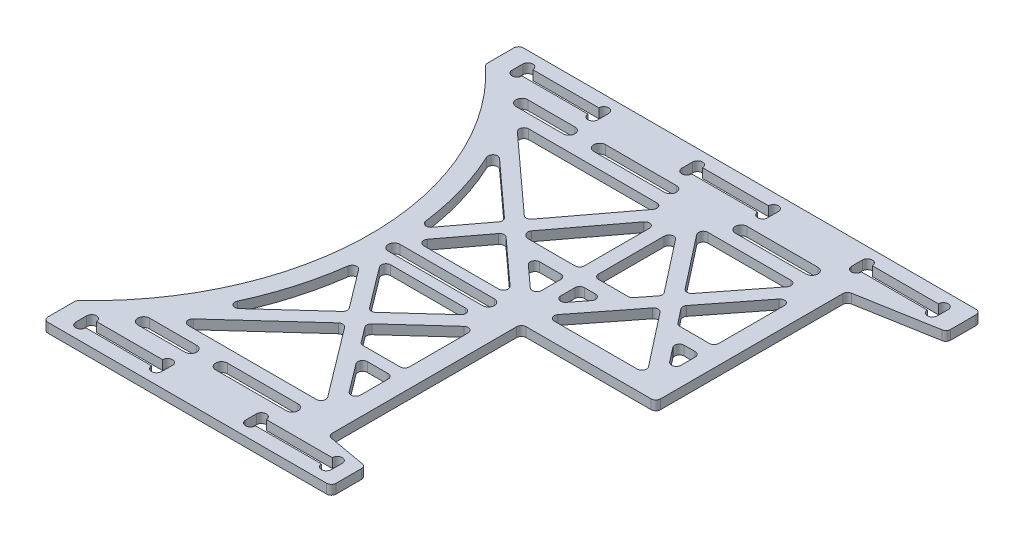
from build123d import *

# Parameters (mm, degrees)
EXTRUDE_1_DEPTH = 2
FILLET_1_R      = 1


with BuildPart() as part:
    # 草图1 → 凸台-拉伸1 (new body)
    with BuildSketch(Plane(origin=(0, 0, 0), x_dir=(1, 0, 0), z_dir=(0, 1, 0))):
        with BuildLine():
            Line((-49, -50.4), (12.1, -50.4))
            Line((12.1, -50.4), (12.1, -43.173885653))
            Line((12.1, -43.173885653), (2.5, -41.481146638))
            Line((2.5, -41.481146638), (2.5, -39.004758069))
            Line((2.5, -39.004758069), (2.5, -0.5))
            Line((2.5, -0.5), (31, -0.5))
            Line((31, -0.5), (31, 40))
            Line((31, 40), (49, 43.173885653))
            Line((49, 43.173885653), (49, 50.4))
            Line((49, 50.4), (-49, 50.4))
            Line((-49, 50.4), (-49, 43.370496884))
            ThreePointArc((-49, 43.370496884), (-30, 0), (-49, -43.370496884))
            Line((-49, -43.370496884), (-49, -50.4))
        make_face()
        with BuildLine():
            Line((-26.9, -45.1), (-26.9, -47.4))
            ThreePointArc((-26.9, -47.4), (-27.95, -48.45), (-29, -47.4))
            Line((-29, -47.4), (-43, -47.4))
            ThreePointArc((-43, -47.4), (-44.05, -48.45), (-45.1, -47.4))
            Line((-45.1, -47.4), (-45.1, -45.1))
            ThreePointArc((-45.1, -45.1), (-44.05, -44.05), (-43, -45.1))
            Line((-43, -45.1), (-29, -45.1))
            ThreePointArc((-29, -45.1), (-27.95, -44.05), (-26.9, -45.1))
        make_face(mode=Mode.SUBTRACT)
        with BuildLine():
            Line((-28, -41.35), (-38, -41.35))
            ThreePointArc((-38, -41.35), (-39.25, -40.1), (-38, -38.85))
            Line((-38, -38.85), (-28, -38.85))
            ThreePointArc((-28, -38.85), (-26.75, -40.1), (-28, -41.35))
        make_face(mode=Mode.SUBTRACT)
        with BuildLine():
            Line((-6.5, -41.35), (-21.5, -41.35))
            ThreePointArc((-21.5, -41.35), (-22.75, -40.1), (-21.5, -38.85))
            Line((-21.5, -38.85), (-6.5, -38.85))
            ThreePointArc((-6.5, -38.85), (-5.25, -40.1), (-6.5, -41.35))
        make_face(mode=Mode.SUBTRACT)
        with BuildLine():
            ThreePointArc((-7, -47.4), (-8.05, -48.45), (-9.1, -47.4))
            Line((-9.1, -47.4), (-9.1, -45.1))
            ThreePointArc((-9.1, -45.1), (-8.05, -44.05), (-7, -45.1))
            Line((-7, -45.1), (7, -45.1))
            ThreePointArc((7, -45.1), (8.05, -44.05), (9.1, -45.1))
            Line((9.1, -45.1), (9.1, -47.4))
            ThreePointArc((9.1, -47.4), (8.05, -48.45), (7, -47.4))
            Line((7, -47.4), (-7, -47.4))
        make_face(mode=Mode.SUBTRACT)
        Polygon((-3.379074314, -36.1), (-35.13850413, -36.1), (-16.298665995, -18.977033898), align=None, mode=Mode.SUBTRACT)
        Polygon((-1.5, -23.75), (-1.5, -33.609571001), (-8.939226985, -23.75), align=None, mode=Mode.SUBTRACT)
        with BuildLine():
            ThreePointArc((-34.333863559, -31.314749346), (-28.925646328, -18.975564048), (-26.264658616, -5.768616943))
            Line((-26.264658616, -5.768616943), (-18.113142059, -16.572220116))
            Line((-18.113142059, -16.572220116), (-34.333863559, -31.314749346))
        make_face(mode=Mode.SUBTRACT)
        Polygon((-10.825522794, -21.25), (-14.069315146, -16.950843506), (-1.5, -5.526968438), (-1.5, -21.25), align=None, mode=Mode.SUBTRACT)
        Polygon((-15.88379121, -14.546029724), (-24.218223041, -3.5), (-3.730206907, -3.5), align=None, mode=Mode.SUBTRACT)
        with BuildLine():
            ThreePointArc((-26.264658616, 5.768616943), (-28.925646328, 18.975564048), (-34.333863559, 31.314749346))
            Line((-34.333863559, 31.314749346), (-18.113142059, 16.572220116))
            Line((-18.113142059, 16.572220116), (-26.264658616, 5.768616943))
        make_face(mode=Mode.SUBTRACT)
        with BuildLine():
            ThreePointArc((-25, -1.25), (-26.25, 0), (-25, 1.25))
            Line((-25, 1.25), (-5, 1.25))
            ThreePointArc((-5, 1.25), (-3.75, 0), (-5, -1.25))
            Line((-5, -1.25), (-25, -1.25))
        make_face(mode=Mode.SUBTRACT)
        Polygon((-3.730206907, 3.5), (-24.218223041, 3.5), (-15.88379121, 14.546029724), align=None, mode=Mode.SUBTRACT)
        Polygon((-9.557291504, 12.85), (-1.5, 12.85), (-1.5, 5.526968438), align=None, mode=Mode.SUBTRACT)
        Polygon((-1.5, 15.85), (-12.858093133, 15.85), (-14.069315146, 16.950843506), (-9.910231684, 22.463080029), (-1.5, 33.609571001), align=None, mode=Mode.SUBTRACT)
        with BuildLine():
            ThreePointArc((-38, 38.85), (-39.25, 40.1), (-38, 41.35))
            Line((-38, 41.35), (-28, 41.35))
            ThreePointArc((-28, 41.35), (-26.75, 40.1), (-28, 38.85))
            Line((-28, 38.85), (-38, 38.85))
        make_face(mode=Mode.SUBTRACT)
        with BuildLine():
            Line((-45.1, 45.1), (-45.1, 47.4))
            ThreePointArc((-45.1, 47.4), (-44.05, 48.45), (-43, 47.4))
            Line((-43, 47.4), (-29, 47.4))
            ThreePointArc((-29, 47.4), (-27.95, 48.45), (-26.9, 47.4))
            Line((-26.9, 47.4), (-26.9, 45.1))
            ThreePointArc((-26.9, 45.1), (-27.95, 44.05), (-29, 45.1))
            Line((-29, 45.1), (-43, 45.1))
            ThreePointArc((-43, 45.1), (-44.05, 44.05), (-45.1, 45.1))
        make_face(mode=Mode.SUBTRACT)
        Polygon((-16.298665995, 18.977033898), (-35.13850413, 36.1), (-3.379074314, 36.1), align=None, mode=Mode.SUBTRACT)
        with BuildLine():
            ThreePointArc((-21.5, 38.85), (-22.75, 40.1), (-21.5, 41.35))
            Line((-21.5, 41.35), (-6.5, 41.35))
            ThreePointArc((-6.5, 41.35), (-5.25, 40.1), (-6.5, 38.85))
            Line((-6.5, 38.85), (-21.5, 38.85))
        make_face(mode=Mode.SUBTRACT)
        with BuildLine():
            ThreePointArc((-9.1, 47.4), (-8.05, 48.45), (-7, 47.4))
            Line((-7, 47.4), (7, 47.4))
            ThreePointArc((7, 47.4), (8.05, 48.45), (9.1, 47.4))
            Line((9.1, 47.4), (9.1, 45.1))
            ThreePointArc((9.1, 45.1), (8.05, 44.05), (7, 45.1))
            Line((7, 45.1), (-7, 45.1))
            ThreePointArc((-7, 45.1), (-8.05, 44.05), (-9.1, 45.1))
            Line((-9.1, 45.1), (-9.1, 47.4))
        make_face(mode=Mode.SUBTRACT)
        Polygon((1.5, 5.934619116), (1.5, 12.85), (6.909270323, 12.85), align=None, mode=Mode.SUBTRACT)
        Polygon((25.095620016, 3.5), (3.404379984, 3.5), (14.25, 17.365380884), align=None, mode=Mode.SUBTRACT)
        Polygon((27, 5.934619116), (21.590729677, 12.85), (27, 12.85), align=None, mode=Mode.SUBTRACT)
        Polygon((1.5, 15.85), (1.5, 33.665380884), (8.282386908, 24.994564679), (12.345620016, 19.8), (9.25589609, 15.85), align=None, mode=Mode.SUBTRACT)
        Polygon((16.154379984, 19.8), (27, 33.665380884), (27, 15.85), (19.24410391, 15.85), align=None, mode=Mode.SUBTRACT)
        Polygon((14.25, 22.234619116), (3.404379984, 36.1), (25.095620016, 36.1), align=None, mode=Mode.SUBTRACT)
        with BuildLine():
            ThreePointArc((8.5, 38.85), (7.25, 40.1), (8.5, 41.35))
            Line((8.5, 41.35), (23.5, 41.35))
            ThreePointArc((23.5, 41.35), (24.75, 40.1), (23.5, 38.85))
            Line((23.5, 38.85), (8.5, 38.85))
        make_face(mode=Mode.SUBTRACT)
        with BuildLine():
            ThreePointArc((26.9, 47.4), (27.95, 48.45), (29, 47.4))
            Line((29, 47.4), (43, 47.4))
            ThreePointArc((43, 47.4), (44.05, 48.45), (45.1, 47.4))
            Line((45.1, 47.4), (45.1, 45.1))
            ThreePointArc((45.1, 45.1), (44.05, 44.05), (43, 45.1))
            Line((43, 45.1), (29, 45.1))
            ThreePointArc((29, 45.1), (27.95, 44.05), (26.9, 45.1))
            Line((26.9, 45.1), (26.9, 47.4))
        make_face(mode=Mode.SUBTRACT)
    extrude(amount=EXTRUDE_1_DEPTH)

    # 圆角1
    fillet_1_edges = [part.edges().sort_by_distance(p)[0] for p in [
        (-18.113142059, 1, 16.572220116),
        (-26.264658616, 1, 5.768616943),
        (-34.333863559, 1, 31.314749346),
        (21.590729677, 1, -12.85),
        (27, 1, -5.934619116),
        (27, 1, -12.85),
        (1.5, 1, -33.665380884),
        (1.5, 1, -15.85),
        (9.25589609, 1, -15.85),
        (12.345620016, 1, -19.8),
        (-14.069315146, 1, -16.950843506),
        (-12.858093133, 1, -15.85),
        (-1.5, 1, -15.85),
        (-1.5, 1, -33.609571001),
        (-3.379074314, 1, 36.1),
        (-16.298665995, 1, 18.977033898),
        (-35.13850413, 1, 36.1),
        (3.404379984, 1, -3.5),
        (25.095620016, 1, -3.5),
        (14.25, 1, -17.365380884),
        (6.909270323, 1, -12.85),
        (1.5, 1, -12.85),
        (1.5, 1, -5.934619116),
        (-24.218223041, 1, -3.5),
        (-3.730206907, 1, -3.5),
        (-15.88379121, 1, -14.546029724),
        (-3.379074314, 1, -36.1),
        (-35.13850413, 1, -36.1),
        (-16.298665995, 1, -18.977033898),
        (25.095620016, 1, -36.1),
        (3.404379984, 1, -36.1),
        (14.25, 1, -22.234619116),
        (-3.730206907, 1, 3.5),
        (-24.218223041, 1, 3.5),
        (-15.88379121, 1, 14.546029724),
        (-1.5, 1, 33.609571001),
        (-1.5, 1, 23.75),
        (-8.939226985, 1, 23.75),
        (-10.825522794, 1, 21.25),
        (-1.5, 1, 21.25),
        (-1.5, 1, 5.526968438),
        (-14.069315146, 1, 16.950843506),
        (-1.5, 1, -5.526968438),
        (-1.5, 1, -12.85),
        (-9.557291504, 1, -12.85),
        (27, 1, -15.85),
        (27, 1, -33.665380884),
        (16.154379984, 1, -19.8),
        (19.24410391, 1, -15.85),
        (-49, 1, -43.370496884),
        (-49, 1, -50.4),
        (49, 1, -50.4),
        (49, 1, -43.173885653),
        (31, 1, -40),
        (31, 1, 0.5),
        (2.5, 1, 0.5),
        (2.5, 1, 41.481146638),
        (12.1, 1, 43.173885653),
        (12.1, 1, 50.4),
        (-49, 1, 50.4),
        (-49, 1, 43.370496884),
        (-26.264658616, 1, -5.768616943),
        (-18.113142059, 1, -16.572220116),
        (-34.333863559, 1, -31.314749346),
    ]]
    fillet(fillet_1_edges, radius=FILLET_1_R)


solid = part.part
